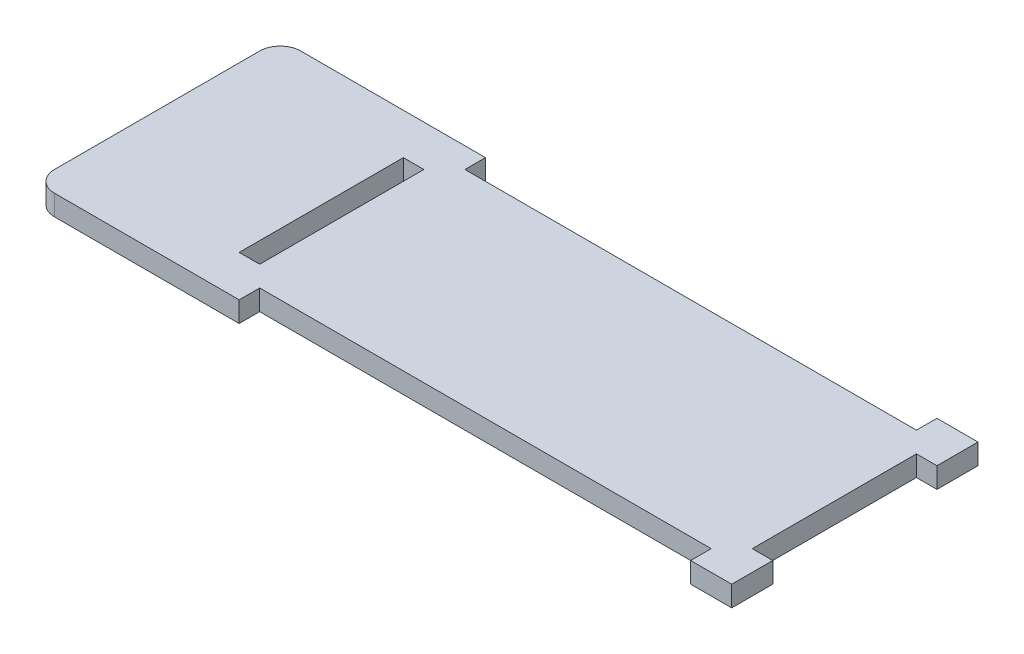
from build123d import *

# Parameters (mm, degrees)
SKETCH1_W           = 6.35
SKETCH1_H           = 50.8
BOSS_EXTRUDE1_DEPTH = 3.175


with BuildPart() as part:
    # Sketch1 → Boss-Extrude1 (new, symmetric)
    with BuildSketch(Plane(origin=(0, 0, 0), x_dir=(1, 0, 0), z_dir=(0, 1, 0))):
        with BuildLine():
            Line((-101.6, -38.1), (-44.45, -38.1))
            Line((-44.45, -38.1), (-44.45, -31.75))
            Line((-44.45, -31.75), (95.25, -31.75))
            Line((95.25, -31.75), (95.25, -38.1))
            Line((95.25, -38.1), (107.95, -38.1))
            Line((107.95, -38.1), (107.95, -25.4))
            Line((107.95, -25.4), (101.6, -25.4))
            Line((101.6, -25.4), (101.6, 25.4))
            Line((101.6, 25.4), (107.95, 25.4))
            Line((107.95, 25.4), (107.95, 38.1))
            Line((107.95, 38.1), (95.25, 38.1))
            Line((95.25, 38.1), (95.25, 31.75))
            Line((95.25, 31.75), (-44.45, 31.75))
            Line((-44.45, 31.75), (-44.45, 38.1))
            Line((-44.45, 38.1), (-101.6, 38.1))
            ThreePointArc((-101.6, 38.1), (-106.090128061, 36.240128061), (-107.95, 31.75))
            Line((-107.95, 31.75), (-107.95, -31.75))
            ThreePointArc((-107.95, -31.75), (-106.090128061, -36.240128061), (-101.6, -38.1))
        make_face()
        with Locations((-53.975, 0)):
            Rectangle(SKETCH1_W, SKETCH1_H, mode=Mode.SUBTRACT)
    extrude(amount=BOSS_EXTRUDE1_DEPTH, both=True)


solid = part.part
